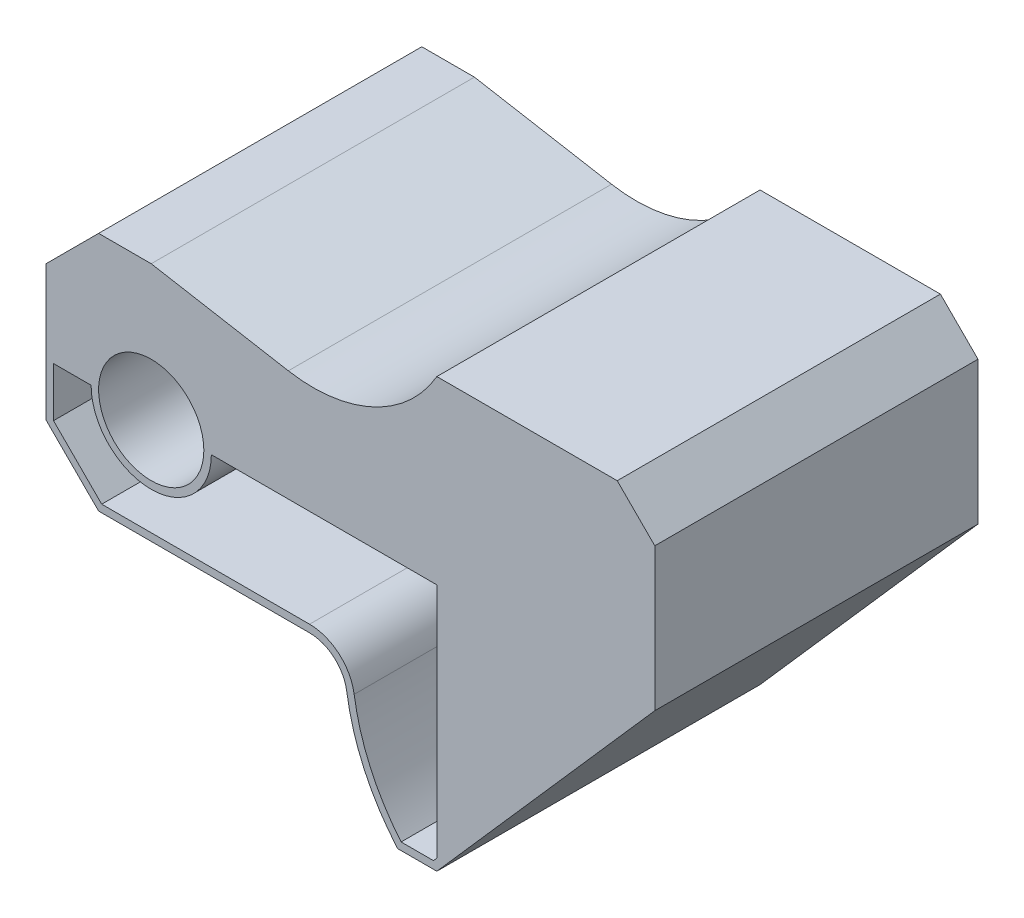
from build123d import *

# Parameters (mm, degrees)
SKETCH1_R           = 7
BOSS_EXTRUDE1_DEPTH = 43
CUT_EXTRUDE1_DEPTH  = 42


with BuildPart() as part:
    # Sketch1 → Boss-Extrude1 (new body)
    with BuildSketch(Plane.XY):
        with BuildLine():
            Line((-14, -7), (-14, 11))
            Line((-14, 11), (-7, 18))
            Line((-7, 18), (0, 18))
            Line((0, 18), (18.243084988, 14.783251905))
            ThreePointArc((18.243084988, 14.783251905), (29.574972961, 16.276069151), (38, 24))
            Line((38, 24), (62, 24))
            Line((62, 24), (67, 19))
            Line((67, 19), (67, 0))
            Line((67, 0), (38, -33))
            Line((38, -33), (32.788067397, -33))
            ThreePointArc((32.788067397, -33), (28.3490952, -26.115672061), (26.012264997, -18.264705882))
            ThreePointArc((26.012264997, -18.264705882), (24.331862036, -15.213413768), (21.066626255, -14))
            Line((21.066626255, -14), (-7, -14))
            Line((-7, -14), (-14, -7))
        make_face()
        Circle(SKETCH1_R, mode=Mode.SUBTRACT)
    extrude(amount=BOSS_EXTRUDE1_DEPTH)

    # Sketch2 → Cut-Extrude1 (cut)
    with BuildSketch(Plane.XY.offset(43)):
        with BuildLine():
            Line((8, 0), (38, 0))
            Line((38, 0), (38, -31.485111542))
            Line((38, -31.485111542), (37.547522264, -32))
            Line((37.547522264, -32), (33.249359107, -32))
            ThreePointArc((33.249359107, -32), (29.163792236, -25.491599052), (27.001392745, -18.117647059))
            ThreePointArc((27.001392745, -18.117647059), (24.984909193, -14.456096521), (21.066626255, -13))
            Line((21.066626255, -13), (-6.585786438, -13))
            Line((-6.585786438, -13), (-13, -6.585786438))
            Line((-13, -6.585786438), (-13, 0))
            Line((-13, 0), (-8, 0))
            ThreePointArc((-8, 0), (0, -8), (8, 0))
        make_face()
    extrude(amount=-CUT_EXTRUDE1_DEPTH, mode=Mode.SUBTRACT)


solid = part.part
